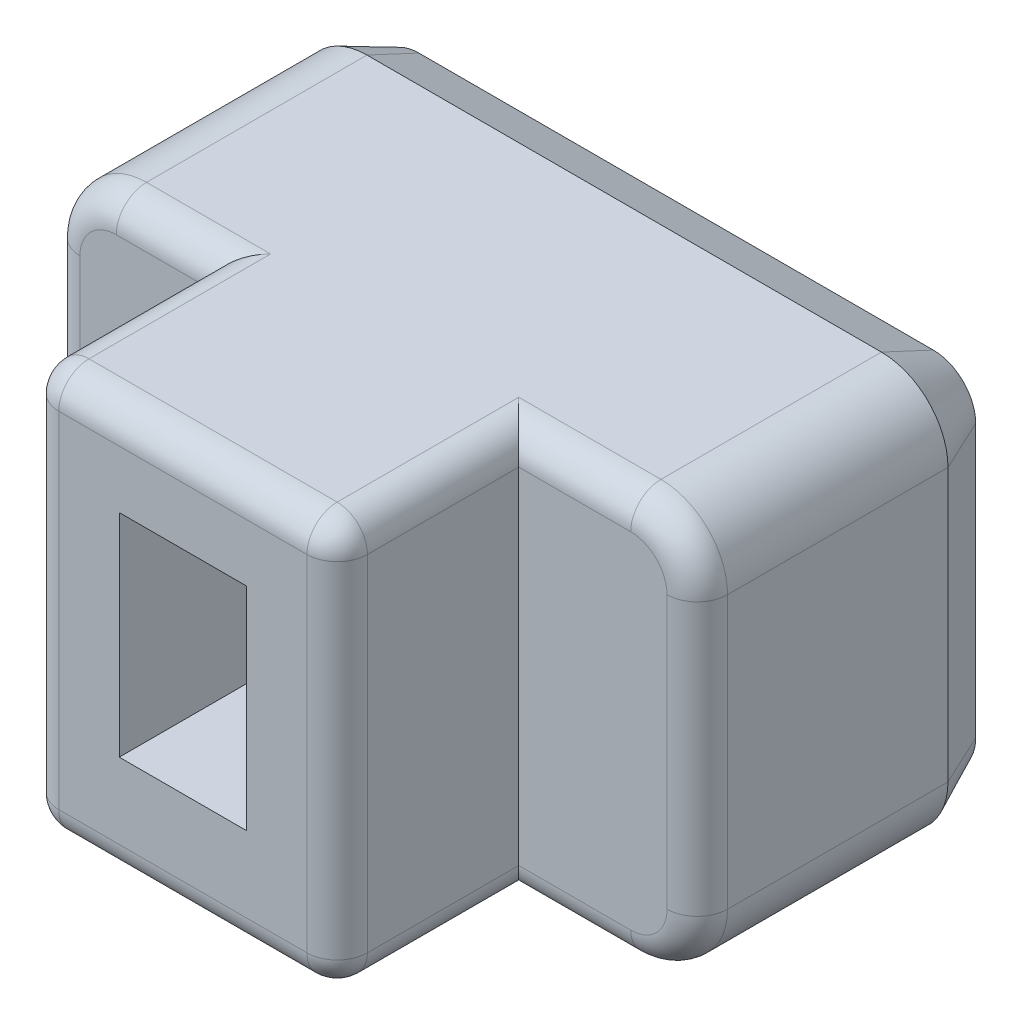
from build123d import *

# Parameters (mm, degrees)
BOSS_EXTRU_1_DEPTH      = 8
ESQUISSE3_W             = 2.1
ESQUISSE3_H             = 3.5
ENL_V_MAT_EXTRU_1_DEPTH = 3
ESQUISSE4_OUTSIDE_W     = 15.69
ESQUISSE4_OUTSIDE_H     = 11.69
ESQUISSE4_OUTSIDE_W_2   = 5.1
ESQUISSE4_OUTSIDE_H_2   = 6.7
ENL_V_MAT_EXTRU_2_DEPTH = 3
CONG_1_R                = 0.5
CHANFREIN1_SIZE         = 0.4
CHANFREIN1_SIZE2        = 0.857802768
ENL_V_MAT_EXTRU_3_DEPTH = 0.3
BOSS_EXTRU_2_START      = -0.2
BOSS_EXTRU_2_DEPTH      = 0.2
BOSS_EXTRU_2_2_DEPTH    = 0.2
BOSS_EXTRU_2_3_DEPTH    = 0.2


with BuildPart() as part:
    # Esquisse2 → Boss.-Extru.1 (new body)
    with BuildSketch(Plane.XY):
        with BuildLine():
            Line((1.1, 0), (9.6, 0))
            ThreePointArc((9.6, 0), (10.377817459, 0.322182541), (10.7, 1.1))
            Line((10.7, 1.1), (10.7, 5.6))
            ThreePointArc((10.7, 5.6), (10.377817459, 6.377817459), (9.6, 6.7))
            Line((9.6, 6.7), (1.1, 6.7))
            ThreePointArc((1.1, 6.7), (0.322182541, 6.377817459), (0, 5.6))
            Line((0, 5.6), (0, 1.1))
            ThreePointArc((0, 1.1), (0.322182541, 0.322182541), (1.1, 0))
        make_face()
    extrude(amount=BOSS_EXTRU_1_DEPTH)

    # Esquisse3 → Enlèv. mat.-Extru.1 (cut)
    with BuildSketch(Plane.XY.offset(8)):
        with Locations((5.2, 3.5)):
            Rectangle(ESQUISSE3_W, ESQUISSE3_H)
    extrude(amount=-ENL_V_MAT_EXTRU_1_DEPTH, mode=Mode.SUBTRACT)

    # Esquisse4 outside → Enlèv. mat.-Extru.2 (cut)
    with BuildSketch(Plane.XY.offset(8)):
        with Locations((5.35, 3.35)):
            Rectangle(ESQUISSE4_OUTSIDE_W, ESQUISSE4_OUTSIDE_H)
        with Locations((5.2, 3.35)):
            Rectangle(ESQUISSE4_OUTSIDE_W_2, ESQUISSE4_OUTSIDE_H_2, mode=Mode.SUBTRACT)
    extrude(amount=-ENL_V_MAT_EXTRU_2_DEPTH, mode=Mode.SUBTRACT)

    # Congé1
    cong_1_edges = [part.edges().sort_by_distance(p)[0] for p in [
        (8.675, 0, 5),
        (10.377817459, 0.322182541, 5),
        (10.7, 3.35, 5),
        (10.377817459, 6.377817459, 5),
        (1.875, 6.7, 5),
        (0.322182541, 6.377817459, 5),
        (1.875, 0, 5),
        (0.322182541, 0.322182541, 5),
        (7.75, 6.7, 6.5),
        (2.65, 6.7, 6.5),
        (7.75, 0, 6.5),
        (2.65, 0, 6.5),
        (2.65, 3.35, 8),
        (5.2, 6.7, 8),
        (7.75, 3.35, 8),
        (5.2, 0, 8),
        (8.675, 6.7, 5),
        (0, 3.35, 5),
    ]]
    fillet(cong_1_edges, radius=CONG_1_R)

    # Chanfrein1
    chanfrein1_edges = [part.edges().sort_by_distance(p)[0] for p in [
        (5.35, 0, 0),
        (10.377817459, 0.322182541, 0),
        (0.322182541, 0.322182541, 0),
        (10.7, 3.35, 0),
        (0, 3.35, 0),
        (10.377817459, 6.377817459, 0),
        (0.322182541, 6.377817459, 0),
        (5.35, 6.7, 0),
    ]]
    chanfrein1_side = [part.faces().sort_by_distance(p)[0] for p in [
        (5.35, 3.35, 0),
    ]]
    chamfer(chanfrein1_edges, length=CHANFREIN1_SIZE, length2=CHANFREIN1_SIZE2, reference=chanfrein1_side[0])

    # Esquisse5 → Enlèv. mat.-Extru.3 (cut)
    with BuildSketch(Plane.XY.offset(0.2)):
        Polygon((1.613362315, 1.356639893), (1.948298212, 1.356639893), (2.972336674, 4.427953995), (3.996375135, 1.356639893), (4.331311033, 1.356639893), (2.997977699, 5.356639893), (2.946695648, 5.356639893), align=None)
        with BuildLine():
            Line((4.536439238, 4.585005277), (4.799259751, 4.382280918))
            add(Edge.make_bspline(
                [(4.799259751, 4.382280918), (4.823346757, 4.434734124), (4.869103771, 4.534377142), (4.945929878, 4.670679709), (5.025934495, 4.785984982), (5.108363743, 4.881707379), (5.195290104, 4.955475471), (5.284732183, 5.00936547), (5.378140643, 5.042884236), (5.442164521, 5.046936478), (5.473939238, 5.048947585)],
                knots=[0, 0, 0, 0, 1.383800419, 2.628744027, 3.746436854, 4.744875104, 5.649467572, 6.46786177, 7.239607766, 8, 8, 8, 8], degree=3))
            add(Edge.make_bspline(
                [(5.473939238, 5.048947585), (5.500740642, 5.047915361), (5.554395409, 5.045848911), (5.633395811, 5.027605196), (5.70948934, 4.997330479), (5.782001755, 4.956651043), (5.849100999, 4.906290216), (5.909274643, 4.847465011), (5.959739618, 4.779569393), (6.001067368, 4.704944558), (6.034150106, 4.625687294), (6.056866948, 4.542959539), (6.072321157, 4.457906397), (6.074033933, 4.400245429), (6.074900776, 4.37106297)],
                knots=[0, 0, 0, 0, 0.957467278, 1.916790714, 2.8816612, 3.878022564, 4.880909137, 5.873739163, 6.876625736, 7.894321194, 8.917782173, 9.939815978, 10.957332139, 12, 12, 12, 12], degree=3))
            add(Edge.make_bspline(
                [(6.074900776, 4.37106297), (6.073372569, 4.33784798), (6.070301543, 4.271100414), (6.049539578, 4.171546978), (6.014988416, 4.072903182), (5.981983522, 4.0103738), (5.965125135, 3.978434764)],
                knots=[0, 0, 0, 0, 0.967036425, 1.943319252, 2.949479453, 4, 4, 4, 4], degree=3))
            add(Edge.make_bspline(
                [(5.965125135, 3.978434764), (5.951527277, 3.955544534), (5.923127647, 3.907737439), (5.872811569, 3.836879973), (5.815972543, 3.762024308), (5.75053318, 3.684373105), (5.677830939, 3.602645186), (5.596693147, 3.518095187), (5.508593718, 3.429587963), (5.446072703, 3.370878839), (5.413843084, 3.340614252)],
                knots=[0, 0, 0, 0, 0.755113658, 1.577082841, 2.46375137, 3.42141287, 4.457284934, 5.566821384, 6.745695014, 8, 8, 8, 8], degree=3))
            add(Edge.make_bspline(
                [(5.413843084, 3.340614252), (5.381639831, 3.310591476), (5.319871388, 3.253005365), (5.233841179, 3.168051464), (5.156564121, 3.090394511), (5.089005588, 3.019250278), (5.031653598, 2.954050532), (4.98185707, 2.896943255), (4.943474119, 2.844749229), (4.921989261, 2.811589806), (4.91224052, 2.796543739)],
                knots=[0, 0, 0, 0, 1.424520873, 2.732346164, 3.911797783, 4.969453705, 5.906063081, 6.721610001, 7.419931359, 8, 8, 8, 8], degree=3))
            add(Edge.make_bspline(
                [(4.91224052, 2.796543739), (4.886020883, 2.749380501), (4.834103922, 2.655993551), (4.780719661, 2.504916726), (4.747207167, 2.348246373), (4.743457797, 2.241425992), (4.741567443, 2.18756938)],
                knots=[0, 0, 0, 0, 1.009954538, 1.999790066, 2.991535804, 4, 4, 4, 4], degree=3))
            add(Edge.make_bspline(
                [(4.741567443, 2.18756938), (4.742822316, 2.145300123), (4.745296589, 2.061956491), (4.764148422, 1.939999856), (4.794435941, 1.823489004), (4.83755148, 1.714000288), (4.892122772, 1.613028432), (4.955957727, 1.521412424), (5.031525739, 1.442361638), (5.115377741, 1.374850896), (5.206482066, 1.321404354), (5.302282958, 1.28180717), (5.402639324, 1.259085711), (5.470893025, 1.25575128), (5.505189238, 1.25407579)],
                knots=[0, 0, 0, 0, 1.133761159, 2.235472776, 3.302779566, 4.358109397, 5.384199343, 6.376419921, 7.344643441, 8.308294326, 9.255929822, 10.168867226, 11.079889886, 12, 12, 12, 12], degree=3))
            add(Edge.make_bspline(
                [(5.505189238, 1.25407579), (5.541963759, 1.255659498), (5.615209803, 1.258813865), (5.722555526, 1.287922739), (5.826292676, 1.333017399), (5.90841381, 1.386290499), (5.972599665, 1.438686688), (6.021631993, 1.486881802), (6.072223738, 1.541794347), (6.122166166, 1.60583863), (6.174468343, 1.675872068), (6.226495835, 1.754194824), (6.279264756, 1.839799037), (6.313599067, 1.900068201), (6.331311033, 1.931159123)],
                knots=[0, 0, 0, 0, 1.174951508, 2.340222187, 3.534605894, 4.784307204, 5.458577557, 6.18406604, 6.982816435, 7.846623665, 8.781884822, 9.780080324, 10.854814883, 12, 12, 12, 12], degree=3))
            Line((6.331311033, 1.931159123), (6.078907187, 2.177152713))
            add(Edge.make_bspline(
                [(6.078907187, 2.177152713), (6.064457845, 2.151898252), (6.036647848, 2.103292126), (5.992728759, 2.035632698), (5.952650096, 1.973253591), (5.911792115, 1.919142288), (5.874924435, 1.869917096), (5.838525913, 1.828153302), (5.804489735, 1.792560002), (5.760993802, 1.755500881), (5.705879198, 1.719432878), (5.637013428, 1.687223386), (5.564689752, 1.668221522), (5.515445065, 1.665630625), (5.490766161, 1.6643322)],
                knots=[0, 0, 0, 0, 1.276827984, 2.457453407, 3.54024844, 4.529789216, 5.432604881, 6.238830133, 6.960111447, 7.592115036, 8.743207621, 9.839626427, 10.917331914, 12, 12, 12, 12], degree=3))
            add(Edge.make_bspline(
                [(5.490766161, 1.6643322), (5.459532425, 1.665746122), (5.398630565, 1.668503091), (5.312857105, 1.698267748), (5.235588363, 1.744298704), (5.169785793, 1.808773895), (5.116806022, 1.886571818), (5.076203752, 1.973399307), (5.054030932, 2.069762465), (5.050880069, 2.136449115), (5.049259751, 2.170742457)],
                knots=[0, 0, 0, 0, 0.995603803, 1.941302263, 2.868878109, 3.853865766, 4.861170307, 5.866733861, 6.902976476, 8, 8, 8, 8], degree=3))
            add(Edge.make_bspline(
                [(5.049259751, 2.170742457), (5.051126522, 2.213681361), (5.054846542, 2.299248109), (5.08374133, 2.404397616), (5.118868235, 2.486952831), (5.153522342, 2.552399891), (5.198197661, 2.619727979), (5.232465964, 2.664278317), (5.250381546, 2.68756938)],
                knots=[0, 0, 0, 0, 1.362911816, 2.715950407, 3.435017459, 4.213622072, 5.066075735, 6, 6, 6, 6], degree=3))
            add(Edge.make_bspline(
                [(5.250381546, 2.68756938), (5.256960472, 2.695404999), (5.272652639, 2.714094654), (5.302668245, 2.74373589), (5.340687347, 2.782089127), (5.387577517, 2.827887601), (5.442901403, 2.882096229), (5.508152544, 2.942619215), (5.5817637, 3.011641084), (5.633912016, 3.060183018), (5.661439238, 3.085806559)],
                knots=[0, 0, 0, 0, 0.428692003, 1.022523547, 1.766726267, 2.693054975, 3.769890224, 5.013497286, 6.423532597, 8, 8, 8, 8], degree=3))
            add(Edge.make_bspline(
                [(5.661439238, 3.085806559), (5.694701419, 3.117441644), (5.759303106, 3.178883192), (5.851005772, 3.270789687), (5.933571818, 3.361087254), (6.008994049, 3.447722523), (6.07567543, 3.532521955), (6.13542352, 3.613700668), (6.185813004, 3.693202952), (6.242249313, 3.79391012), (6.298144321, 3.91940785), (6.346543937, 4.071467319), (6.376940934, 4.224021852), (6.380718988, 4.326057399), (6.382593084, 4.376671944)],
                knots=[0, 0, 0, 0, 1.084389401, 2.106097175, 3.066173385, 3.974339943, 4.818837423, 5.613947617, 6.354352105, 7.040737217, 8.339964108, 9.591128425, 10.805083687, 12, 12, 12, 12], degree=3))
            add(Edge.make_bspline(
                [(6.382593084, 4.376671944), (6.381812904, 4.412490469), (6.38027134, 4.483264539), (6.368348974, 4.587658095), (6.346893905, 4.688176273), (6.319512325, 4.785610943), (6.281980021, 4.878925265), (6.237276145, 4.968900667), (6.183839193, 5.05501734), (6.123757042, 5.136655479), (6.057786812, 5.211754342), (5.986999871, 5.277875744), (5.912835001, 5.334156291), (5.834728186, 5.379698741), (5.753242565, 5.415223765), (5.668043088, 5.44091678), (5.579226237, 5.456695362), (5.518875609, 5.458361563), (5.488362315, 5.459203995)],
                knots=[0, 0, 0, 0, 1.104658156, 2.182701625, 3.23448937, 4.272148491, 5.300148647, 6.331707503, 7.367369959, 8.421864184, 9.454902215, 10.445791729, 11.404694568, 12.3202605, 13.227823242, 14.139973149, 15.059569905, 16, 16, 16, 16], degree=3))
            add(Edge.make_bspline(
                [(5.488362315, 5.459203995), (5.46482155, 5.45860577), (5.417811417, 5.457411134), (5.348436966, 5.447253257), (5.280087286, 5.432373429), (5.214056851, 5.409585404), (5.149305893, 5.381495921), (5.08660975, 5.346769713), (5.025560211, 5.305673892), (4.965928978, 5.258138126), (4.907644126, 5.203042152), (4.851057332, 5.139422589), (4.794968945, 5.068095377), (4.74005118, 4.988260237), (4.687815082, 4.899120172), (4.635791198, 4.802054625), (4.584088402, 4.697024102), (4.552641124, 4.623094429), (4.536439238, 4.585005277)],
                knots=[0, 0, 0, 0, 0.820398924, 1.638309618, 2.440372394, 3.256159469, 4.069390881, 4.898884307, 5.751274568, 6.632679565, 7.555005562, 8.544212762, 9.598733613, 10.717275191, 11.919963767, 13.199151059, 14.556980458, 16, 16, 16, 16], degree=3))
        make_face()
        Polygon((7.81849052, 3.202793739), (7.81849052, 2.023306559), (8.126182828, 2.023306559), (8.126182828, 3.202793739), (9.049259751, 3.202793739), (9.049259751, 3.561768098), (8.126182828, 3.561768098), (8.126182828, 4.741255277), (7.81849052, 4.741255277), (7.81849052, 3.561768098), (6.895413597, 3.561768098), (6.895413597, 3.202793739), align=None)
    extrude(amount=-ENL_V_MAT_EXTRU_3_DEPTH, mode=Mode.SUBTRACT)


with BuildPart() as body_2:
    # Esquisse5<3> → Boss.-Extru.2 (new body)
    with BuildSketch(Plane.XY.offset(0.2).offset(BOSS_EXTRU_2_START)):
        Polygon((1.613362315, 1.356639893), (1.948298212, 1.356639893), (2.972336674, 4.427953995), (3.996375135, 1.356639893), (4.331311033, 1.356639893), (2.997977699, 5.356639893), (2.946695648, 5.356639893), align=None)
    extrude(amount=-BOSS_EXTRU_2_DEPTH)


with BuildPart() as body_3:
    # Esquisse5<3> → Boss.-Extru.2 2 (new body)
    with BuildSketch(Plane.XY.offset(0.2).offset(BOSS_EXTRU_2_START)):
        with BuildLine():
            Line((4.536439238, 4.585005277), (4.799259751, 4.382280918))
            add(Edge.make_bspline(
                [(4.799259751, 4.382280918), (4.823346757, 4.434734124), (4.869103771, 4.534377142), (4.945929878, 4.670679709), (5.025934495, 4.785984982), (5.108363743, 4.881707379), (5.195290104, 4.955475471), (5.284732183, 5.00936547), (5.378140643, 5.042884236), (5.442164521, 5.046936478), (5.473939238, 5.048947585)],
                knots=[0, 0, 0, 0, 1.383800419, 2.628744027, 3.746436854, 4.744875104, 5.649467572, 6.46786177, 7.239607766, 8, 8, 8, 8], degree=3))
            add(Edge.make_bspline(
                [(5.473939238, 5.048947585), (5.500740642, 5.047915361), (5.554395409, 5.045848911), (5.633395811, 5.027605196), (5.70948934, 4.997330479), (5.782001755, 4.956651043), (5.849100999, 4.906290216), (5.909274643, 4.847465011), (5.959739618, 4.779569393), (6.001067368, 4.704944558), (6.034150106, 4.625687294), (6.056866948, 4.542959539), (6.072321157, 4.457906397), (6.074033933, 4.400245429), (6.074900776, 4.37106297)],
                knots=[0, 0, 0, 0, 0.957467278, 1.916790714, 2.8816612, 3.878022564, 4.880909137, 5.873739163, 6.876625736, 7.894321194, 8.917782173, 9.939815978, 10.957332139, 12, 12, 12, 12], degree=3))
            add(Edge.make_bspline(
                [(6.074900776, 4.37106297), (6.073372569, 4.33784798), (6.070301543, 4.271100414), (6.049539578, 4.171546978), (6.014988416, 4.072903182), (5.981983522, 4.0103738), (5.965125135, 3.978434764)],
                knots=[0, 0, 0, 0, 0.967036425, 1.943319252, 2.949479453, 4, 4, 4, 4], degree=3))
            add(Edge.make_bspline(
                [(5.965125135, 3.978434764), (5.951527277, 3.955544534), (5.923127647, 3.907737439), (5.872811569, 3.836879973), (5.815972543, 3.762024308), (5.75053318, 3.684373105), (5.677830939, 3.602645186), (5.596693147, 3.518095187), (5.508593718, 3.429587963), (5.446072703, 3.370878839), (5.413843084, 3.340614252)],
                knots=[0, 0, 0, 0, 0.755113658, 1.577082841, 2.46375137, 3.42141287, 4.457284934, 5.566821384, 6.745695014, 8, 8, 8, 8], degree=3))
            add(Edge.make_bspline(
                [(5.413843084, 3.340614252), (5.381639831, 3.310591476), (5.319871388, 3.253005365), (5.233841179, 3.168051464), (5.156564121, 3.090394511), (5.089005588, 3.019250278), (5.031653598, 2.954050532), (4.98185707, 2.896943255), (4.943474119, 2.844749229), (4.921989261, 2.811589806), (4.91224052, 2.796543739)],
                knots=[0, 0, 0, 0, 1.424520873, 2.732346164, 3.911797783, 4.969453705, 5.906063081, 6.721610001, 7.419931359, 8, 8, 8, 8], degree=3))
            add(Edge.make_bspline(
                [(4.91224052, 2.796543739), (4.886020883, 2.749380501), (4.834103922, 2.655993551), (4.780719661, 2.504916726), (4.747207167, 2.348246373), (4.743457797, 2.241425992), (4.741567443, 2.18756938)],
                knots=[0, 0, 0, 0, 1.009954538, 1.999790066, 2.991535804, 4, 4, 4, 4], degree=3))
            add(Edge.make_bspline(
                [(4.741567443, 2.18756938), (4.742822316, 2.145300123), (4.745296589, 2.061956491), (4.764148422, 1.939999856), (4.794435941, 1.823489004), (4.83755148, 1.714000288), (4.892122772, 1.613028432), (4.955957727, 1.521412424), (5.031525739, 1.442361638), (5.115377741, 1.374850896), (5.206482066, 1.321404354), (5.302282958, 1.28180717), (5.402639324, 1.259085711), (5.470893025, 1.25575128), (5.505189238, 1.25407579)],
                knots=[0, 0, 0, 0, 1.133761159, 2.235472776, 3.302779566, 4.358109397, 5.384199343, 6.376419921, 7.344643441, 8.308294326, 9.255929822, 10.168867226, 11.079889886, 12, 12, 12, 12], degree=3))
            add(Edge.make_bspline(
                [(5.505189238, 1.25407579), (5.541963759, 1.255659498), (5.615209803, 1.258813865), (5.722555526, 1.287922739), (5.826292676, 1.333017399), (5.90841381, 1.386290499), (5.972599665, 1.438686688), (6.021631993, 1.486881802), (6.072223738, 1.541794347), (6.122166166, 1.60583863), (6.174468343, 1.675872068), (6.226495835, 1.754194824), (6.279264756, 1.839799037), (6.313599067, 1.900068201), (6.331311033, 1.931159123)],
                knots=[0, 0, 0, 0, 1.174951508, 2.340222187, 3.534605894, 4.784307204, 5.458577557, 6.18406604, 6.982816435, 7.846623665, 8.781884822, 9.780080324, 10.854814883, 12, 12, 12, 12], degree=3))
            Line((6.331311033, 1.931159123), (6.078907187, 2.177152713))
            add(Edge.make_bspline(
                [(6.078907187, 2.177152713), (6.064457845, 2.151898252), (6.036647848, 2.103292126), (5.992728759, 2.035632698), (5.952650096, 1.973253591), (5.911792115, 1.919142288), (5.874924435, 1.869917096), (5.838525913, 1.828153302), (5.804489735, 1.792560002), (5.760993802, 1.755500881), (5.705879198, 1.719432878), (5.637013428, 1.687223386), (5.564689752, 1.668221522), (5.515445065, 1.665630625), (5.490766161, 1.6643322)],
                knots=[0, 0, 0, 0, 1.276827984, 2.457453407, 3.54024844, 4.529789216, 5.432604881, 6.238830133, 6.960111447, 7.592115036, 8.743207621, 9.839626427, 10.917331914, 12, 12, 12, 12], degree=3))
            add(Edge.make_bspline(
                [(5.490766161, 1.6643322), (5.459532425, 1.665746122), (5.398630565, 1.668503091), (5.312857105, 1.698267748), (5.235588363, 1.744298704), (5.169785793, 1.808773895), (5.116806022, 1.886571818), (5.076203752, 1.973399307), (5.054030932, 2.069762465), (5.050880069, 2.136449115), (5.049259751, 2.170742457)],
                knots=[0, 0, 0, 0, 0.995603803, 1.941302263, 2.868878109, 3.853865766, 4.861170307, 5.866733861, 6.902976476, 8, 8, 8, 8], degree=3))
            add(Edge.make_bspline(
                [(5.049259751, 2.170742457), (5.051126522, 2.213681361), (5.054846542, 2.299248109), (5.08374133, 2.404397616), (5.118868235, 2.486952831), (5.153522342, 2.552399891), (5.198197661, 2.619727979), (5.232465964, 2.664278317), (5.250381546, 2.68756938)],
                knots=[0, 0, 0, 0, 1.362911816, 2.715950407, 3.435017459, 4.213622072, 5.066075735, 6, 6, 6, 6], degree=3))
            add(Edge.make_bspline(
                [(5.250381546, 2.68756938), (5.256960472, 2.695404999), (5.272652639, 2.714094654), (5.302668245, 2.74373589), (5.340687347, 2.782089127), (5.387577517, 2.827887601), (5.442901403, 2.882096229), (5.508152544, 2.942619215), (5.5817637, 3.011641084), (5.633912016, 3.060183018), (5.661439238, 3.085806559)],
                knots=[0, 0, 0, 0, 0.428692003, 1.022523547, 1.766726267, 2.693054975, 3.769890224, 5.013497286, 6.423532597, 8, 8, 8, 8], degree=3))
            add(Edge.make_bspline(
                [(5.661439238, 3.085806559), (5.694701419, 3.117441644), (5.759303106, 3.178883192), (5.851005772, 3.270789687), (5.933571818, 3.361087254), (6.008994049, 3.447722523), (6.07567543, 3.532521955), (6.13542352, 3.613700668), (6.185813004, 3.693202952), (6.242249313, 3.79391012), (6.298144321, 3.91940785), (6.346543937, 4.071467319), (6.376940934, 4.224021852), (6.380718988, 4.326057399), (6.382593084, 4.376671944)],
                knots=[0, 0, 0, 0, 1.084389401, 2.106097175, 3.066173385, 3.974339943, 4.818837423, 5.613947617, 6.354352105, 7.040737217, 8.339964108, 9.591128425, 10.805083687, 12, 12, 12, 12], degree=3))
            add(Edge.make_bspline(
                [(6.382593084, 4.376671944), (6.381812904, 4.412490469), (6.38027134, 4.483264539), (6.368348974, 4.587658095), (6.346893905, 4.688176273), (6.319512325, 4.785610943), (6.281980021, 4.878925265), (6.237276145, 4.968900667), (6.183839193, 5.05501734), (6.123757042, 5.136655479), (6.057786812, 5.211754342), (5.986999871, 5.277875744), (5.912835001, 5.334156291), (5.834728186, 5.379698741), (5.753242565, 5.415223765), (5.668043088, 5.44091678), (5.579226237, 5.456695362), (5.518875609, 5.458361563), (5.488362315, 5.459203995)],
                knots=[0, 0, 0, 0, 1.104658156, 2.182701625, 3.23448937, 4.272148491, 5.300148647, 6.331707503, 7.367369959, 8.421864184, 9.454902215, 10.445791729, 11.404694568, 12.3202605, 13.227823242, 14.139973149, 15.059569905, 16, 16, 16, 16], degree=3))
            add(Edge.make_bspline(
                [(5.488362315, 5.459203995), (5.46482155, 5.45860577), (5.417811417, 5.457411134), (5.348436966, 5.447253257), (5.280087286, 5.432373429), (5.214056851, 5.409585404), (5.149305893, 5.381495921), (5.08660975, 5.346769713), (5.025560211, 5.305673892), (4.965928978, 5.258138126), (4.907644126, 5.203042152), (4.851057332, 5.139422589), (4.794968945, 5.068095377), (4.74005118, 4.988260237), (4.687815082, 4.899120172), (4.635791198, 4.802054625), (4.584088402, 4.697024102), (4.552641124, 4.623094429), (4.536439238, 4.585005277)],
                knots=[0, 0, 0, 0, 0.820398924, 1.638309618, 2.440372394, 3.256159469, 4.069390881, 4.898884307, 5.751274568, 6.632679565, 7.555005562, 8.544212762, 9.598733613, 10.717275191, 11.919963767, 13.199151059, 14.556980458, 16, 16, 16, 16], degree=3))
        make_face()
    extrude(amount=-BOSS_EXTRU_2_2_DEPTH)


with BuildPart() as body_4:
    # Esquisse5<3> → Boss.-Extru.2 3 (new body)
    with BuildSketch(Plane.XY.offset(0.2).offset(BOSS_EXTRU_2_START)):
        Polygon((7.81849052, 3.202793739), (7.81849052, 2.023306559), (8.126182828, 2.023306559), (8.126182828, 3.202793739), (9.049259751, 3.202793739), (9.049259751, 3.561768098), (8.126182828, 3.561768098), (8.126182828, 4.741255277), (7.81849052, 4.741255277), (7.81849052, 3.561768098), (6.895413597, 3.561768098), (6.895413597, 3.202793739), align=None)
    extrude(amount=-BOSS_EXTRU_2_3_DEPTH)


solid = Compound([part.part, body_2.part, body_3.part, body_4.part])
